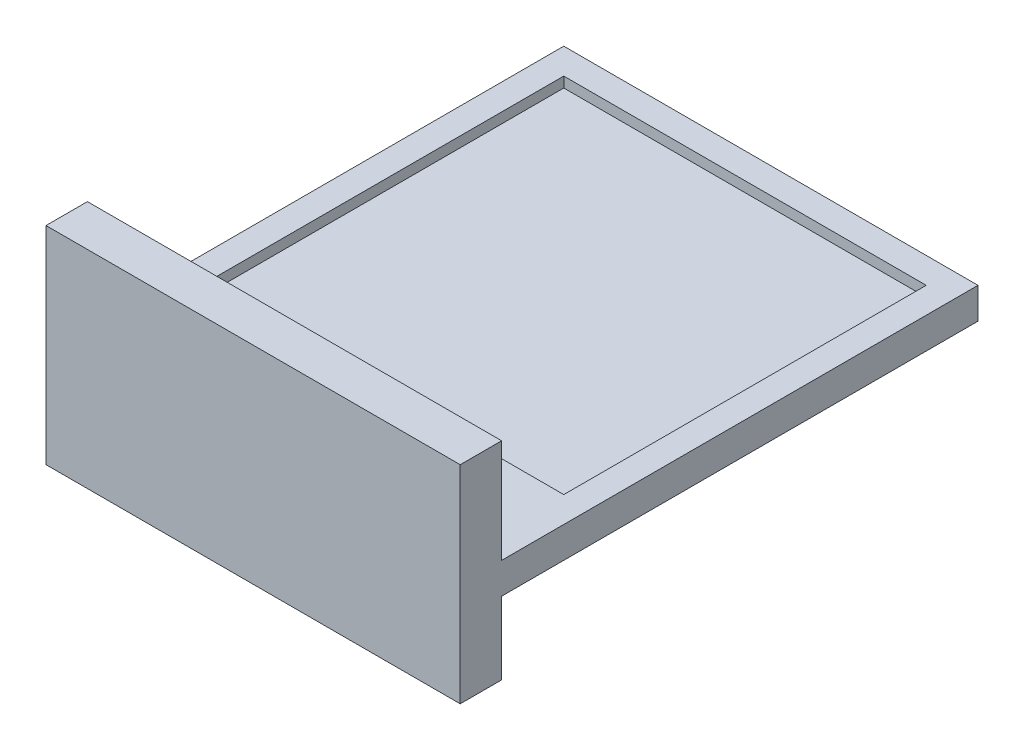
from build123d import *

# Parameters (mm, degrees)
SKETCH1_W                = 8
SKETCH1_H                = 10
BOSS_EXTRUDE1_DEPTH      = 0.6
SKETCH4_W                = 7
SKETCH4_H                = 7
CUT_EXTRUDE1_DEPTH       = 0.4
SKETCH5_W                = 7.4
SKETCH5_H                = 0.2
CUT_EXTRUDE2_DEPTH       = 8
BOSS_EXTRUDE2_DEPTH      = 2
BOSS_EXTRUDE2_DEPTH_BACK = 2
SKETCH6_W                = 8
SKETCH6_H                = 0.8


with BuildPart() as part:
    # Sketch1 → Boss-Extrude1 (new body)
    with BuildSketch(Plane(origin=(0, 0, 0), x_dir=(1, 0, 0), z_dir=(0, 1, 0))):
        Rectangle(SKETCH1_W, SKETCH1_H)
    extrude(amount=BOSS_EXTRUDE1_DEPTH)

    # Sketch4 → Cut-Extrude1 (cut)
    with BuildSketch(Plane(origin=(0, 0.6, 0), x_dir=(1, 0, 0), z_dir=(0, 1, 0))):
        with Locations((0, 1)):
            Rectangle(SKETCH4_W, SKETCH4_H)
    extrude(amount=-CUT_EXTRUDE1_DEPTH, mode=Mode.SUBTRACT)

    # Sketch5 → Cut-Extrude2 (cut)
    with BuildSketch(Plane(origin=(0, 0, -5), x_dir=(-1, 0, 0), z_dir=(0, 0, -1))):
        with Locations((0, 0.3)):
            Rectangle(SKETCH5_W, SKETCH5_H)
    extrude(amount=-CUT_EXTRUDE2_DEPTH, mode=Mode.SUBTRACT)

    # Sketch6 → Boss-Extrude2 (add, two sides: drawn at the far end of the back side and taken through both)
    with BuildSketch(Plane(origin=(0, 0.6, 0), x_dir=(1, 0, 0), z_dir=(0, 1, 0)).offset(-BOSS_EXTRUDE2_DEPTH_BACK)):
        with Locations((0, -4.6)):
            Rectangle(SKETCH6_W, SKETCH6_H)
    extrude(amount=BOSS_EXTRUDE2_DEPTH + BOSS_EXTRUDE2_DEPTH_BACK)


solid = part.part
